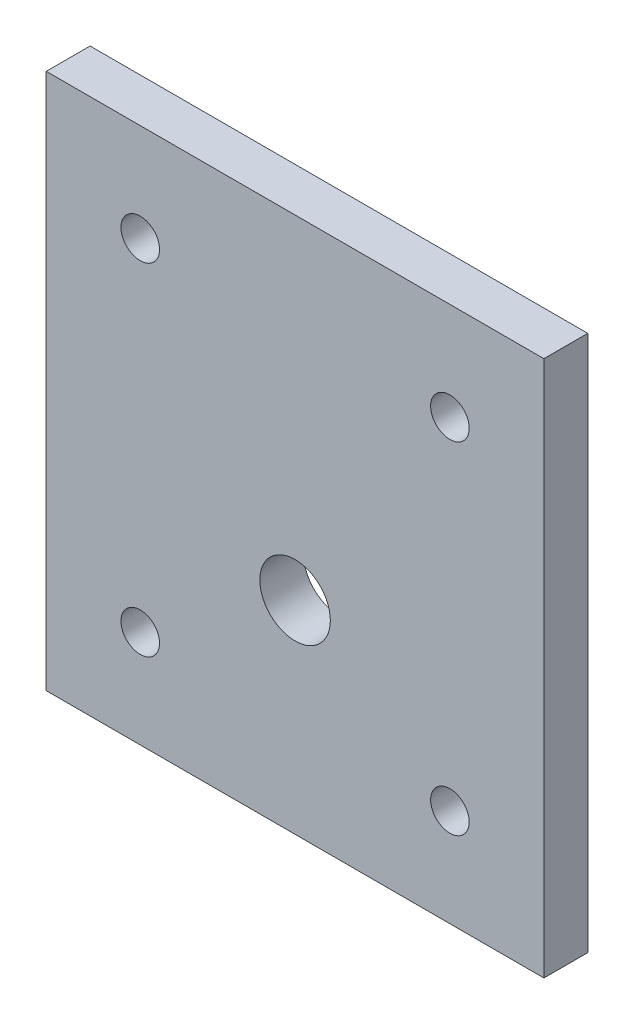
from build123d import *

# Parameters (mm, degrees)
SKETCH1_W           = 36.024962638
SKETCH1_H           = 38.826904176
SKETCH1_R           = 1.397
SKETCH1_R_2         = 2.5527
BOSS_EXTRUDE1_DEPTH = 3.175


with BuildPart() as part:
    # Sketch1 → Boss-Extrude1 (new body)
    with BuildSketch(Plane.XY):
        with Locations((34.711147671, -14.342506761)):
            Rectangle(SKETCH1_W, SKETCH1_H)
        with Locations((45.918913825, -2.000621413)):
            Circle(SKETCH1_R, mode=Mode.SUBTRACT)
        with Locations((23.503381517, -2.000621413)):
            Circle(SKETCH1_R, mode=Mode.SUBTRACT)
        with Locations((23.503381517, -26.684392109)):
            Circle(SKETCH1_R, mode=Mode.SUBTRACT)
        with Locations((45.918913825, -26.684392109)):
            Circle(SKETCH1_R, mode=Mode.SUBTRACT)
        with Locations((34.711147671, -19.079122219)):
            Circle(SKETCH1_R_2, mode=Mode.SUBTRACT)
    extrude(amount=BOSS_EXTRUDE1_DEPTH)


solid = part.part
